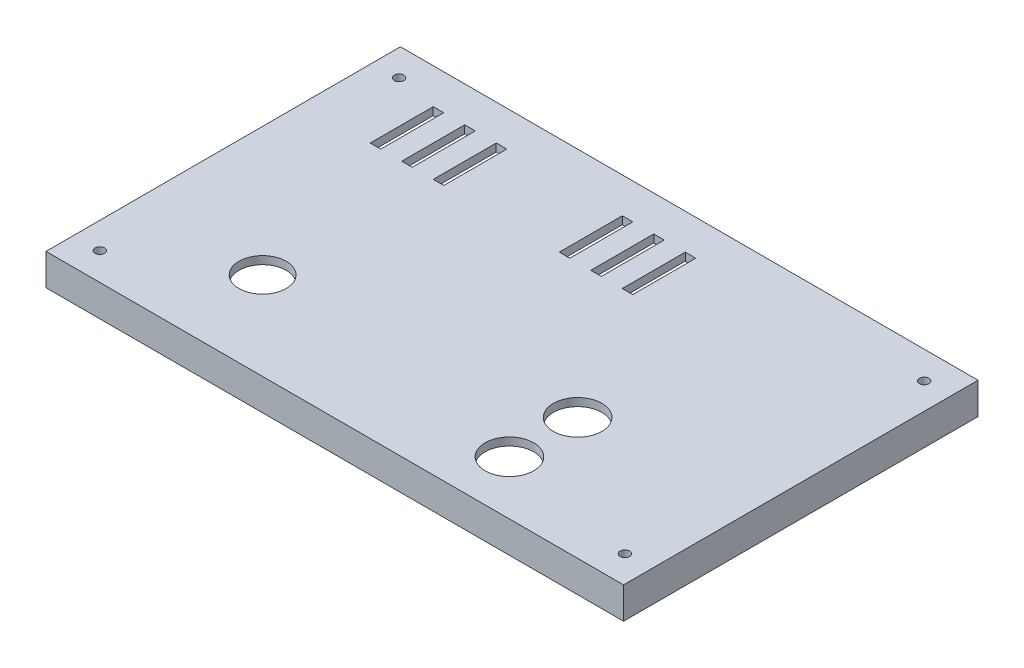
from build123d import *

# Parameters (mm, degrees)
SKETCH_1_W                       = 220
SKETCH_1_H                       = 135
LID_TOP_3MM_DEPTH                = 3
SKETCH_2_W                       = 216
SKETCH_2_H                       = 2
LID_RIM_BACK_DEPTH               = 12
SKETCH_3_W                       = 216
SKETCH_3_H                       = 2
LID_RIM_FRONT_DEPTH              = 12
SKETCH_4_W                       = 2
SKETCH_4_H                       = 135
LID_RIM_LEFT_DEPTH               = 12
SKETCH_5_W                       = 2
SKETCH_5_H                       = 135
LID_RIM_RIGHT_DEPTH              = 12
SKETCH_6_R                       = 1.8
LID_SCREW_CLEARANCE_1_DEPTH      = 16
SKETCH_7_R                       = 1.8
LID_SCREW_CLEARANCE_2_DEPTH      = 16
SKETCH_8_R                       = 1.8
LID_SCREW_CLEARANCE_3_DEPTH      = 16
SKETCH_9_R                       = 1.8
LID_SCREW_CLEARANCE_4_DEPTH      = 16
SKETCH_10_R                      = 9
OV5647_LENS_OPENING_D18_DEPTH    = 4
SKETCH_11_R                      = 9.25
HC_SR04_ACOUSTIC_OPENING_1_DEPTH = 4
SKETCH_12_R                      = 9.25
HC_SR04_ACOUSTIC_OPENING_2_DEPTH = 4
SKETCH_13_W                      = 4
SKETCH_13_H                      = 24
VENT_SLOT_1_DEPTH                = 4
SKETCH_14_W                      = 4
SKETCH_14_H                      = 24
VENT_SLOT_2_DEPTH                = 4
SKETCH_15_W                      = 4
SKETCH_15_H                      = 24
VENT_SLOT_3_DEPTH                = 4
SKETCH_16_W                      = 4
SKETCH_16_H                      = 24
VENT_SLOT_4_DEPTH                = 4
SKETCH_17_W                      = 4
SKETCH_17_H                      = 24
VENT_SLOT_5_DEPTH                = 4
SKETCH_18_W                      = 4
SKETCH_18_H                      = 24
VENT_SLOT_6_DEPTH                = 4


with BuildPart() as part:
    # 草图1 → Lid_Top_3mm (new body)
    with BuildSketch(Plane(origin=(0, 0, 0), x_dir=(1, 0, 0), z_dir=(0, 1, 0))):
        Rectangle(SKETCH_1_W, SKETCH_1_H)
    extrude(amount=-LID_TOP_3MM_DEPTH)

    # 草图2 → Lid_Rim_Back (add)
    with BuildSketch(Plane(origin=(0, 0, 0), x_dir=(1, 0, 0), z_dir=(0, 1, 0))):
        with Locations((0, 66.5)):
            Rectangle(SKETCH_2_W, SKETCH_2_H)
    extrude(amount=-LID_RIM_BACK_DEPTH)

    # 草图3 → Lid_Rim_Front (add)
    with BuildSketch(Plane(origin=(0, 0, 0), x_dir=(1, 0, 0), z_dir=(0, 1, 0))):
        with Locations((0, -66.5)):
            Rectangle(SKETCH_3_W, SKETCH_3_H)
    extrude(amount=-LID_RIM_FRONT_DEPTH)

    # 草图4 → Lid_Rim_Left (add)
    with BuildSketch(Plane(origin=(0, 0, 0), x_dir=(1, 0, 0), z_dir=(0, 1, 0))):
        with Locations((-109, 0)):
            Rectangle(SKETCH_4_W, SKETCH_4_H)
    extrude(amount=-LID_RIM_LEFT_DEPTH)

    # 草图5 → Lid_Rim_Right (add)
    with BuildSketch(Plane(origin=(0, 0, 0), x_dir=(1, 0, 0), z_dir=(0, 1, 0))):
        with Locations((109, 0)):
            Rectangle(SKETCH_5_W, SKETCH_5_H)
    extrude(amount=-LID_RIM_RIGHT_DEPTH)

    # 草图6 → Lid_Screw_Clearance_1 (cut)
    with BuildSketch(Plane(origin=(0, 0, 0), x_dir=(1, 0, 0), z_dir=(0, 1, 0))):
        with Locations(Location((-100, -57, 0), (0, 0, 270))):
            Circle(SKETCH_6_R)
    extrude(amount=-LID_SCREW_CLEARANCE_1_DEPTH, mode=Mode.SUBTRACT)

    # 草图7 → Lid_Screw_Clearance_2 (cut)
    with BuildSketch(Plane(origin=(0, 0, 0), x_dir=(1, 0, 0), z_dir=(0, 1, 0))):
        with Locations(Location((100, -57, 0), (0, 0, 270))):
            Circle(SKETCH_7_R)
    extrude(amount=-LID_SCREW_CLEARANCE_2_DEPTH, mode=Mode.SUBTRACT)

    # 草图8 → Lid_Screw_Clearance_3 (cut)
    with BuildSketch(Plane(origin=(0, 0, 0), x_dir=(1, 0, 0), z_dir=(0, 1, 0))):
        with Locations(Location((-100, 57, 0), (0, 0, 270))):
            Circle(SKETCH_8_R)
    extrude(amount=-LID_SCREW_CLEARANCE_3_DEPTH, mode=Mode.SUBTRACT)

    # 草图9 → Lid_Screw_Clearance_4 (cut)
    with BuildSketch(Plane(origin=(0, 0, 0), x_dir=(1, 0, 0), z_dir=(0, 1, 0))):
        with Locations(Location((100, 57, 0), (0, 0, 270))):
            Circle(SKETCH_9_R)
    extrude(amount=-LID_SCREW_CLEARANCE_4_DEPTH, mode=Mode.SUBTRACT)

    # 草图10 → OV5647_Lens_Opening_D18 (cut)
    with BuildSketch(Plane(origin=(0, 0, 0), x_dir=(1, 0, 0), z_dir=(0, 1, 0))):
        with Locations(Location((-61, -34, 0), (0, 0, 270))):
            Circle(SKETCH_10_R)
    extrude(amount=-OV5647_LENS_OPENING_D18_DEPTH, mode=Mode.SUBTRACT)

    # 草图11 → HC_SR04_Acoustic_Opening_1 (cut)
    with BuildSketch(Plane(origin=(0, 0, 0), x_dir=(1, 0, 0), z_dir=(0, 1, 0))):
        with Locations(Location((46, -47, 0), (0, 0, 270))):
            Circle(SKETCH_11_R)
    extrude(amount=-HC_SR04_ACOUSTIC_OPENING_1_DEPTH, mode=Mode.SUBTRACT)

    # 草图12 → HC_SR04_Acoustic_Opening_2 (cut)
    with BuildSketch(Plane(origin=(0, 0, 0), x_dir=(1, 0, 0), z_dir=(0, 1, 0))):
        with Locations(Location((46, -21, 0), (0, 0, 270))):
            Circle(SKETCH_12_R)
    extrude(amount=-HC_SR04_ACOUSTIC_OPENING_2_DEPTH, mode=Mode.SUBTRACT)

    # 草图13 → Vent_Slot_1 (cut)
    with BuildSketch(Plane(origin=(0, 0, 0), x_dir=(1, 0, 0), z_dir=(0, 1, 0))):
        with Locations((-82, 42)):
            Rectangle(SKETCH_13_W, SKETCH_13_H)
    extrude(amount=-VENT_SLOT_1_DEPTH, mode=Mode.SUBTRACT)

    # 草图14 → Vent_Slot_2 (cut)
    with BuildSketch(Plane(origin=(0, 0, 0), x_dir=(1, 0, 0), z_dir=(0, 1, 0))):
        with Locations((-70, 42)):
            Rectangle(SKETCH_14_W, SKETCH_14_H)
    extrude(amount=-VENT_SLOT_2_DEPTH, mode=Mode.SUBTRACT)

    # 草图15 → Vent_Slot_3 (cut)
    with BuildSketch(Plane(origin=(0, 0, 0), x_dir=(1, 0, 0), z_dir=(0, 1, 0))):
        with Locations((-58, 42)):
            Rectangle(SKETCH_15_W, SKETCH_15_H)
    extrude(amount=-VENT_SLOT_3_DEPTH, mode=Mode.SUBTRACT)

    # 草图16 → Vent_Slot_4 (cut)
    with BuildSketch(Plane(origin=(0, 0, 0), x_dir=(1, 0, 0), z_dir=(0, 1, 0))):
        with Locations((-10, 42)):
            Rectangle(SKETCH_16_W, SKETCH_16_H)
    extrude(amount=-VENT_SLOT_4_DEPTH, mode=Mode.SUBTRACT)

    # 草图17 → Vent_Slot_5 (cut)
    with BuildSketch(Plane(origin=(0, 0, 0), x_dir=(1, 0, 0), z_dir=(0, 1, 0))):
        with Locations((2, 42)):
            Rectangle(SKETCH_17_W, SKETCH_17_H)
    extrude(amount=-VENT_SLOT_5_DEPTH, mode=Mode.SUBTRACT)

    # 草图18 → Vent_Slot_6 (cut)
    with BuildSketch(Plane(origin=(0, 0, 0), x_dir=(1, 0, 0), z_dir=(0, 1, 0))):
        with Locations((14, 42)):
            Rectangle(SKETCH_18_W, SKETCH_18_H)
    extrude(amount=-VENT_SLOT_6_DEPTH, mode=Mode.SUBTRACT)


solid = part.part
